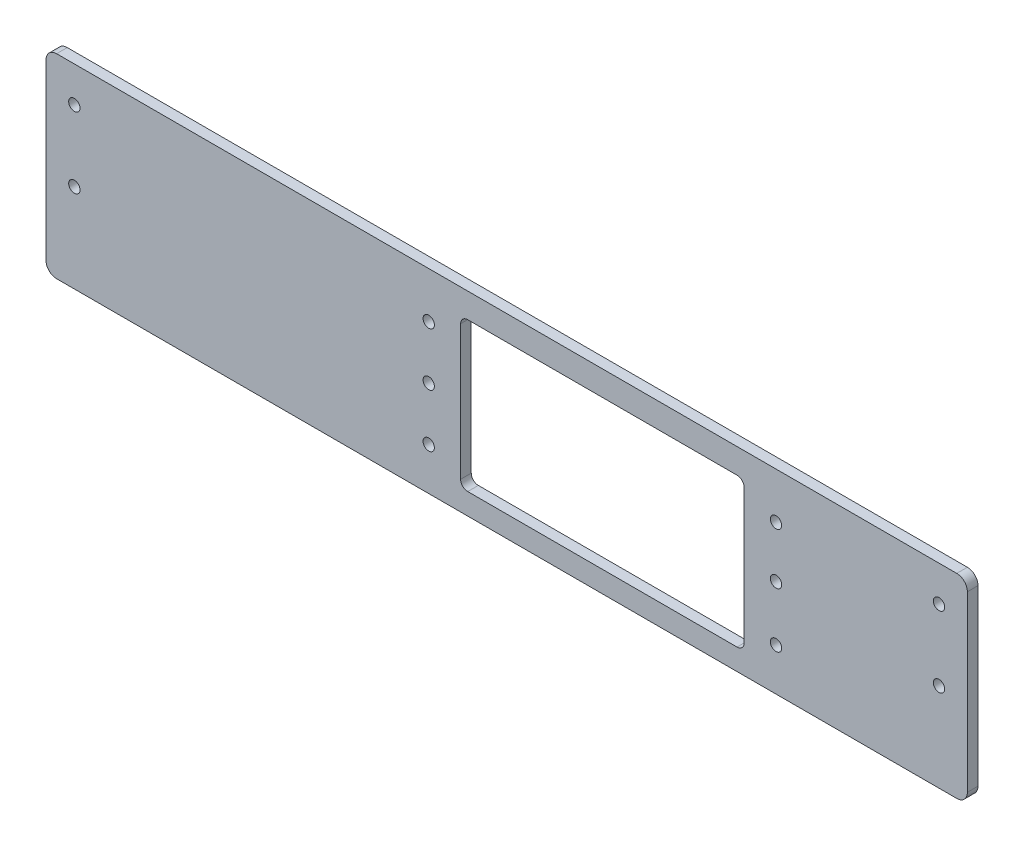
from build123d import *

# Parameters (mm, degrees)
SKETCH_1_W          = 260
SKETCH_1_H          = 55
EXTRUDE_1_DEPTH     = 3
FILLET_1_R          = 3
SKETCH_2_R          = 1.6
CUT_EXTRUDE_1_DEPTH = 48
SKETCH_3_R          = 1.6
SKETCH_3_W          = 80
SKETCH_3_H          = 42
CUT_EXTRUDE_2_DEPTH = 327
FILLET_2_R          = 2


with BuildPart() as part:
    # 草图1 → 凸台-拉伸1 (new body)
    with BuildSketch(Plane.XY):
        Rectangle(SKETCH_1_W, SKETCH_1_H)
    extrude(amount=EXTRUDE_1_DEPTH)

    # 圆角1
    fillet_1_edges = [part.edges().sort_by_distance(p)[0] for p in [
        (-130, 27.5, 1.5),
        (130, 27.5, 1.5),
        (130, -27.5, 1.5),
        (-130, -27.5, 1.5),
    ]]
    fillet(fillet_1_edges, radius=FILLET_1_R)

    # 草图2 → 切除-拉伸1 (cut)
    with BuildSketch(Plane.XY.offset(3)):
        with Locations((-122, 17.5)):
            Circle(SKETCH_2_R)
        with Locations((-122, -2.5)):
            Circle(SKETCH_2_R)
        with Locations((122, -2.5)):
            Circle(SKETCH_2_R)
        with Locations((122, 17.5)):
            Circle(SKETCH_2_R)
    extrude(amount=-CUT_EXTRUDE_1_DEPTH, mode=Mode.SUBTRACT)

    # 草图3 → 切除-拉伸2 (cut)
    with BuildSketch(Plane.XY.offset(3)):
        with Locations((-22, 14.5)):
            Circle(SKETCH_3_R)
        with Locations((-22, -0.5)):
            Circle(SKETCH_3_R)
        with Locations((-22, -15.5)):
            Circle(SKETCH_3_R)
        with Locations((76, 14.5)):
            Circle(SKETCH_3_R)
        with Locations((76, 0)):
            Circle(SKETCH_3_R)
        with Locations((76, -15.5)):
            Circle(SKETCH_3_R)
        with Locations((27, -0.5)):
            Rectangle(SKETCH_3_W, SKETCH_3_H)
    extrude(amount=-CUT_EXTRUDE_2_DEPTH, mode=Mode.SUBTRACT)

    # 圆角2
    fillet_2_edges = [part.edges().sort_by_distance(p)[0] for p in [
        (-13, -21.5, 1.5),
        (-13, 20.5, 1.5),
        (67, 20.5, 1.5),
        (67, -21.5, 1.5),
    ]]
    fillet(fillet_2_edges, radius=FILLET_2_R)


solid = part.part
